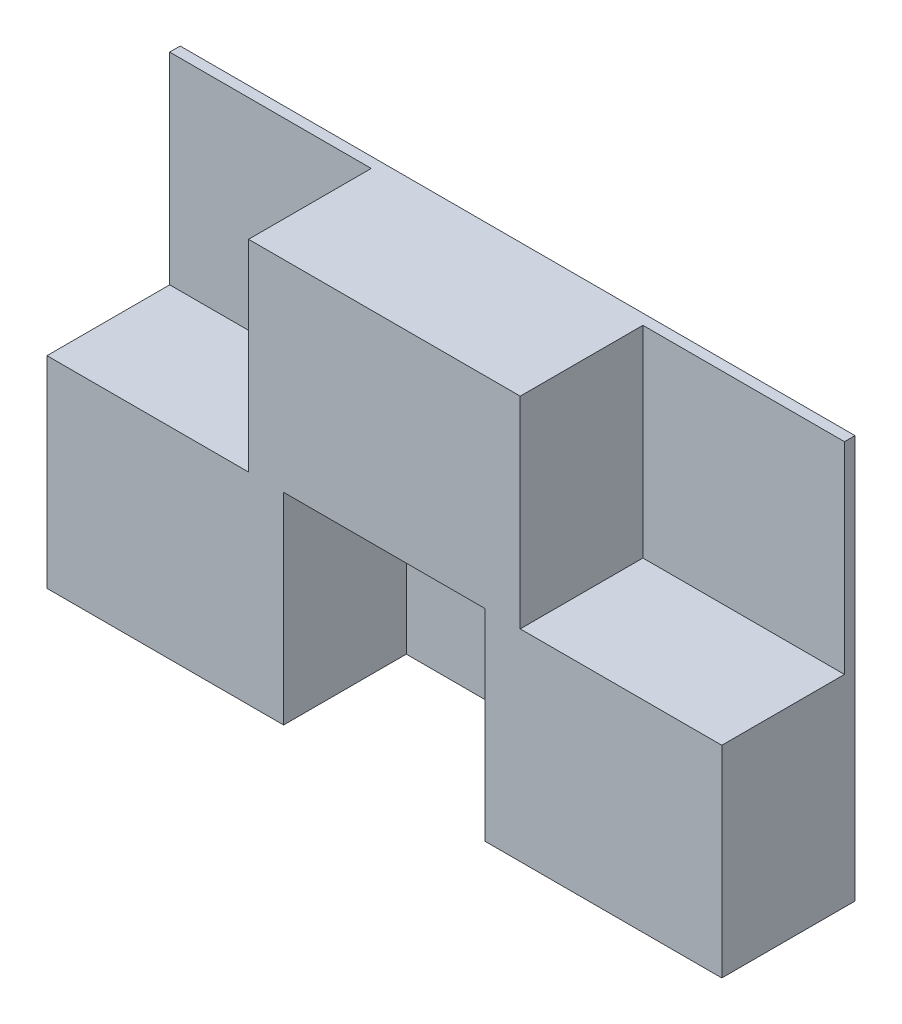
from build123d import *

# Parameters (mm, degrees)
SKETCH1_W           = 192.5
SKETCH1_H           = 115
BOSS_EXTRUDE1_DEPTH = 3
BOSS_EXTRUDE2_DEPTH = 35


with BuildPart() as part:
    # Sketch1 → Boss-Extrude1 (new body)
    with BuildSketch(Plane.XY):
        with Locations((96.25, 57.5)):
            Rectangle(SKETCH1_W, SKETCH1_H)
    extrude(amount=BOSS_EXTRUDE1_DEPTH)

    # Sketch2 → Boss-Extrude2 (add)
    with BuildSketch(Plane.XY.offset(3)):
        Polygon((0, 57.5), (0, 0), (67.5, 0), (67.5, 57.5), (125, 57.5), (125, 0), (192.5, 0), (192.5, 57.5), (135, 57.5), (135, 115), (57.5, 115), (57.5, 57.5), align=None)
    extrude(amount=BOSS_EXTRUDE2_DEPTH)


solid = part.part
